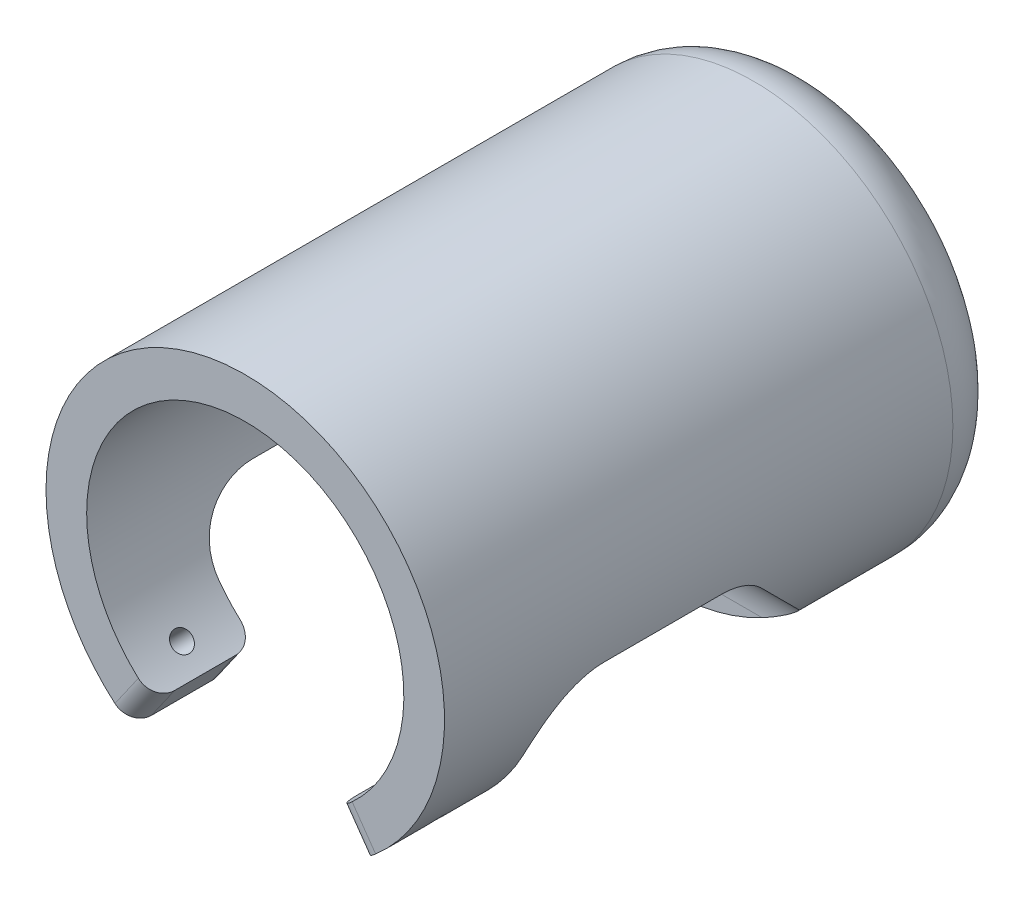
from build123d import *

# Parameters (mm, degrees)
SKETCH_1_R               = 49
EXTRUDE_1_DEPTH          = 70
FILLET_1_R               = 15
SHELL_1_T                = -10
CUT_EXTRUDE_1_DEPTH      = 99.498731006
CUT_EXTRUDE_1_DEPTH_BACK = 99.498731006
CUT_EXTRUDE_2_REACH      = 158.211
SKETCH_4_R               = 30
CUT_EXTRUDE_3_DEPTH      = 157.211395294
FILLET_2_R               = 5


with BuildPart() as part:
    # 草图1 → 凸台-拉伸1 (new, symmetric)
    with BuildSketch(Plane.XY):
        Circle(SKETCH_1_R)
    extrude(amount=EXTRUDE_1_DEPTH, both=True)

    # 圆角1
    fillet_1_edges = [part.edges().sort_by_distance(p)[0] for p in [
        (-49, 0, -70),
    ]]
    fillet(fillet_1_edges, radius=FILLET_1_R)

    # 抽壳1
    shell_1_openings = [part.faces().sort_by_distance(p)[0] for p in [
        (0, 0, 70),
    ]]
    offset(amount=SHELL_1_T, openings=shell_1_openings, kind=Kind.INTERSECTION)

    # 草图2 → 切除-拉伸1 (cut, two sides: drawn at the far end of the back side and taken through both)
    with BuildSketch(Plane(origin=(0, 0, 0), x_dir=(0, 0, -1), z_dir=(1, 0, 0)).offset(-CUT_EXTRUDE_1_DEPTH_BACK)):
        with BuildLine():
            Line((-45, -49), (-45, -23))
            ThreePointArc((-45, -23), (-40.606601718, -12.393398282), (-30, -8))
            Line((-30, -8), (-1.213203436, -8))
            ThreePointArc((-1.213203436, -8), (4.52704805, -9.141807012), (9.393398282, -12.393398282))
            Line((9.393398282, -12.393398282), (29.606601718, -32.606601718))
            ThreePointArc((29.606601718, -32.606601718), (32.858192988, -37.47295195), (34, -43.213203436))
            Line((34, -43.213203436), (34, -49))
            Line((34, -49), (-45, -49))
        make_face()
    extrude(amount=CUT_EXTRUDE_1_DEPTH + CUT_EXTRUDE_1_DEPTH_BACK, mode=Mode.SUBTRACT)

    # 草图3 → 切除-拉伸2 (cut, up to next)
    with BuildSketch(Plane.XY.offset(70), mode=Mode.PRIVATE) as cut_extrude_2_sk1:
        with BuildLine():
            Line((22.369481018, -31.946929727), (28.105245381, -40.13845017))
            ThreePointArc((28.105245381, -40.13845017), (0, -49), (-28.105245381, -40.13845017))
            Line((-28.105245381, -40.13845017), (-22.369481018, -31.946929727))
            ThreePointArc((-22.369481018, -31.946929727), (0, -39), (22.369481018, -31.946929727))
        make_face()
    cut_extrude_2_tool1 = extrude(cut_extrude_2_sk1.sketch, amount=-CUT_EXTRUDE_2_REACH, mode=Mode.PRIVATE) & part.part
    add(cut_extrude_2_tool1.solids().sort_by_distance((0, -41.491958, 70))[0], mode=Mode.SUBTRACT)

    # 草图4 → 切除-拉伸3 (cut, through all)
    with BuildSketch(Plane.XY.offset(70)):
        Circle(SKETCH_4_R)
    extrude(amount=-CUT_EXTRUDE_3_DEPTH, mode=Mode.SUBTRACT)

    # 圆角2
    fillet_2_edges = [part.edges().sort_by_distance(p)[0] for p in [
        (25.237363199, -36.042689949, 45),
        (-25.237363199, -36.042689949, 45),
        (-25.237363199, -36.042689949, 70),
        (25.237363199, -36.042689949, 70),
    ]]
    fillet(fillet_2_edges, radius=FILLET_2_R)

    # 草图6 → 切除-旋转1 (revolve, cut)
    with BuildSketch(Plane.XY.offset(58), mode=Mode.PRIVATE) as cut_revolve_1_sk:
        Polygon((0, 0), (1.767766953, 1.767766953), (56.3134362, -52.777902294), (54.545669247, -54.545669247), align=None)
    cut_revolve_1 = revolve(cut_revolve_1_sk.sketch.rotate(Axis((0, 0, 58), (0.7071067811865438, -0.7071067811865512, 0)), 180), axis=Axis((0, 0, 58), (0.7071067811865438, -0.7071067811865512, 0)), mode=Mode.SUBTRACT)

    # 镜向2: 切除-旋转1 across plane
    add(cut_revolve_1.mirror(Plane(origin=(0, 0, 0), x_dir=(0, 0, 1), z_dir=(1, 0, 0))), mode=Mode.SUBTRACT)


solid = part.part
